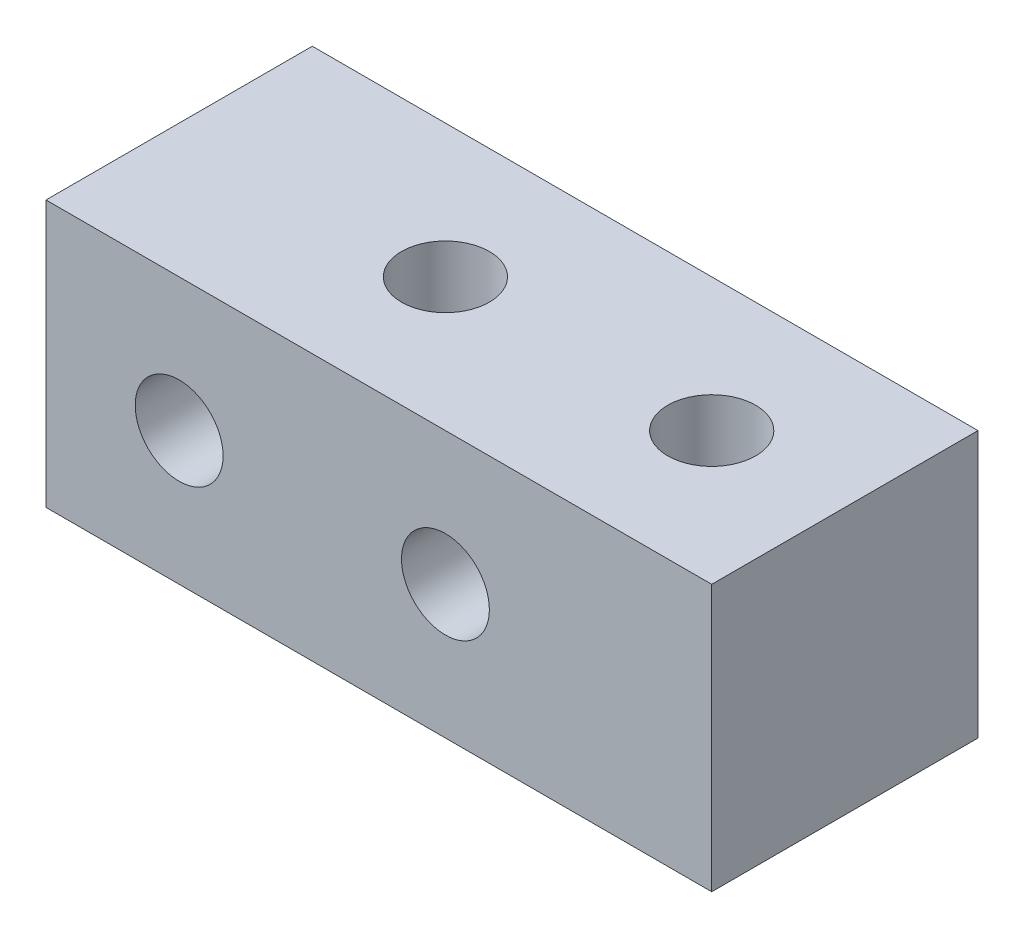
from build123d import *

# Parameters (mm, degrees)
SKETCH_1_W                   = 25
SKETCH_1_H                   = 10
EXTRUDE_1_DEPTH              = 10
HOLE_WIZARD_M4_1_D           = 3.3
HOLE_WIZARD_M4_1_ON_FACE_2_D = 3.3


with BuildPart() as part:
    # 草图1 → 凸台-拉伸1 (new body)
    with BuildSketch(Plane.XY):
        Rectangle(SKETCH_1_W, SKETCH_1_H)
    extrude(amount=EXTRUDE_1_DEPTH)

    # M4 螺纹孔的螺纹孔钻头1 (through all)
    with Locations(Plane(origin=(-2.5, 5, 5), x_dir=(1, 0, 0), z_dir=(0, 1, 0))):
        with Locations((0, 0), (10, 0)):
            Hole(HOLE_WIZARD_M4_1_D / 2)

    # M4 螺纹孔的螺纹孔钻头1 on face 2 (through all)
    with Locations(Plane(origin=(2.5, 0, 10), x_dir=(1, 0, 0), z_dir=(0, 0, 1))):
        with Locations((0, 0), (-10, 0)):
            Hole(HOLE_WIZARD_M4_1_ON_FACE_2_D / 2)


solid = part.part
